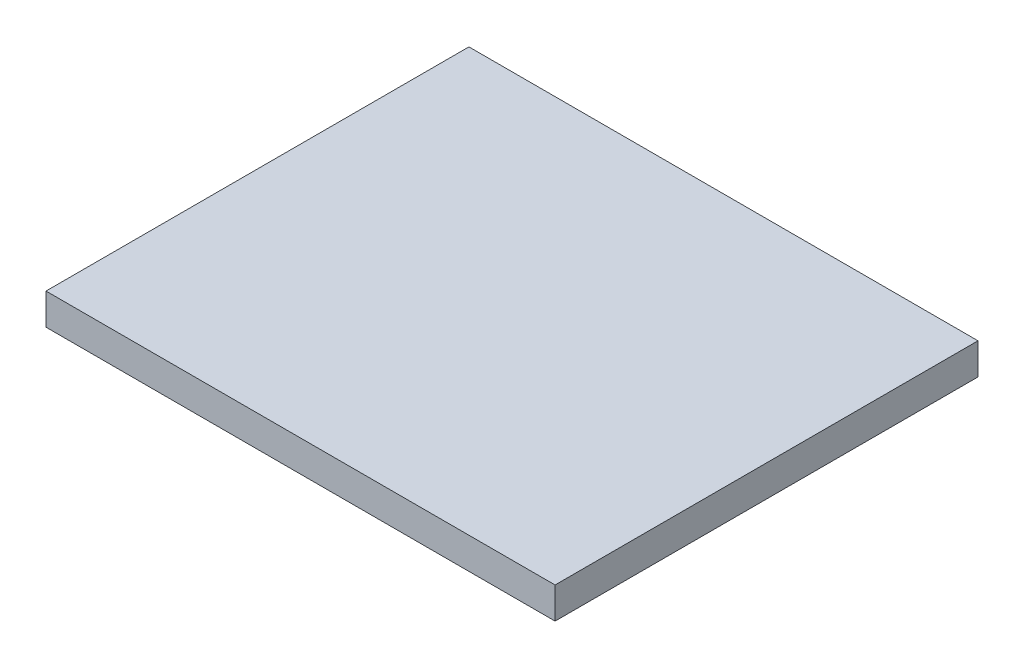
from build123d import *

# Parameters (mm, degrees)
SKETCH1_W           = 412.75
SKETCH1_H           = 342.9
BOSS_EXTRUDE1_DEPTH = 12.7


with BuildPart() as part:
    # Sketch1 → Boss-Extrude1 (new, symmetric)
    with BuildSketch(Plane(origin=(0, 0, 0), x_dir=(1, 0, 0), z_dir=(0, 1, 0))):
        Rectangle(SKETCH1_W, SKETCH1_H)
    extrude(amount=BOSS_EXTRUDE1_DEPTH, both=True)


solid = part.part
